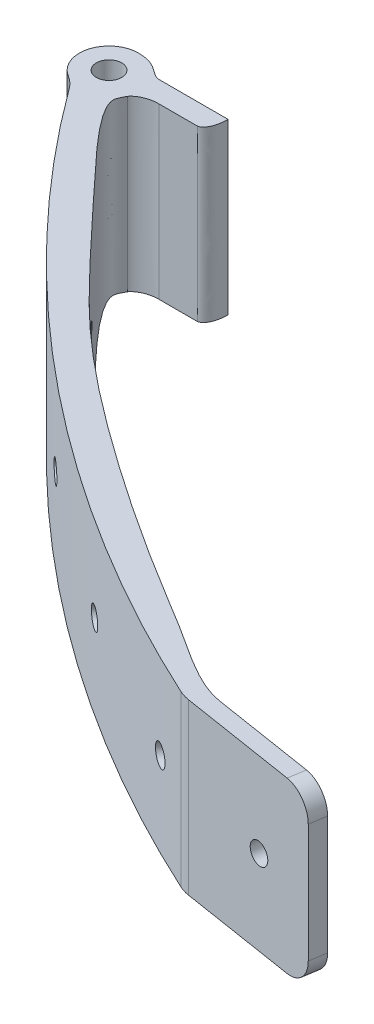
from build123d import *

# Parameters (mm, degrees)
SKETCH_1_R               = 1.5
EXTRUDE_1_DEPTH          = 20
SKETCH_2_R               = 1.25
CUT_EXTRUDE_1_DEPTH      = 117.587125453
CUT_EXTRUDE_2_DEPTH      = 125.160942129
CUT_EXTRUDE_2_DEPTH_BACK = 125.160942129
SKETCH_5_R               = 1.25
CUT_EXTRUDE_START        = -5
SKETCH_6_R               = 1.25
CUT_EXTRUDE_3_DEPTH      = 78.365221441
CUT_EXTRUDE_START_2      = 10
SKETCH_7_R               = 1.25
CUT_EXTRUDE_5_DEPTH      = 81.224751973
SKETCH_8_R               = 1.25
CUT_EXTRUDE_6_DEPTH      = 97.006719329
FILLET_1_R               = 3


with BuildPart() as part:
    # Эскиз1 → Бобышка-Вытянуть1 (new body)
    with BuildSketch(Plane(origin=(0, 0, 0), x_dir=(1, 0, 0), z_dir=(0, 1, 0))):
        with BuildLine():
            Line((77.201963586, -81.223148621), (93.992665376, -83.882534527))
            Line((93.992665376, -83.882534527), (94.305534306, -81.907157846))
            Line((94.305534306, -81.907157846), (79.490209197, -79.56064087))
            add(Edge.make_bspline(
                [(79.490209197, -79.56064087), (76.256773952, -79.154348442), (71.656260447, -75.733682797), (61.0670462, -69.403824403), (49.779121917, -62.08745812), (36.271463551, -52.16601557), (26.152496922, -41.879924323), (21.275507444, -36.599319235), (15.121863873, -30.013690286), (10.698464666, -24.931258261), (11.523891951, -23.700720545), (11.847061913, -23.072072966)],
                knots=[0, 0, 0, 0, 0.11695499, 0.15293265, 0.359776594, 0.631849253, 0.683687702, 0.856552932, 0.887565935, 0.972209575, 1, 1, 1, 1], degree=3))
            add(Edge.make_bspline(
                [(11.847061913, -23.072072966), (12.250121588, -22.515440182), (13.311252633, -21.971386221), (14.497358583, -22)],
                knots=[0, 0, 0, 0, 1, 1, 1, 1], degree=3))
            Line((14.497358583, -22), (18.997358583, -22))
            add(Edge.make_bspline(
                [(20.143207518, -19.5), (20.126602545, -21.364997031), (19.36969675, -21.993414121), (18.997358583, -22)],
                knots=[0, 0, 0, 0, 1, 1, 1, 1], degree=3))
            Line((20.143207518, -19.5), (12.143207518, -19.5))
            add(Edge.make_bspline(
                [(8.070926194, -18), (10.594209658, -18.022875603), (10.911300873, -19.549452414), (12.143207518, -19.5)],
                knots=[0, 0, 0, 0, 1, 1, 1, 1], degree=3))
            ThreePointArc((8.070926194, -18), (4.704156478, -20.54351598), (6.230776804, -24.477221897))
            ThreePointArc((6.230776804, -24.477221897), (6.996911803, -25.059630547), (7.63727688, -25.778028236))
            add(Edge.make_bspline(
                [(7.63727688, -25.778028236), (33.668412058, -61.357283375), (75.890541462, -80.825286428)],
                knots=[4.149854874, 4.149854874, 4.149854874, 4.761288535, 4.761288535, 4.761288535], degree=2, weights=[1, 0.953631448, 1]))
            ThreePointArc((75.890541462, -80.825286428), (76.532556696, -81.069361324), (77.201963586, -81.223148621))
        make_face()
        with Locations(Location((8.070926194, -21.5, 0), (0, 0, 270))):
            Circle(SKETCH_1_R, mode=Mode.SUBTRACT)
    extrude(amount=EXTRUDE_1_DEPTH)

    # Эскиз2 → Вырез-Вытянуть1 (cut, through all)
    with BuildSketch(Plane(origin=(-10.347531177, 0, 65.331740641), x_dir=(-0.9876883405951379, 0, -0.1564344650402302), z_dir=(0.1564344650402302, 0, -0.9876883405951379))):
        with Locations((-98.957579108, 10)):
            Circle(SKETCH_2_R)
    extrude(amount=-CUT_EXTRUDE_1_DEPTH, mode=Mode.SUBTRACT)

    # Эскиз5 → Вырез-Вытянуть2 (cut, two sides: drawn at the far end of the back side and taken through both)
    with BuildSketch(Plane(origin=(-15.990680125, 0, 30.490731825), x_dir=(-0.8856004845364605, 0, -0.46444782461411815), z_dir=(0.46444782461411815, 0, -0.8856004845364605)).offset(-CUT_EXTRUDE_2_DEPTH_BACK)):
        with Locations((-99.552036869, 10)):
            Circle(SKETCH_5_R)
    extrude(amount=CUT_EXTRUDE_2_DEPTH + CUT_EXTRUDE_2_DEPTH_BACK, mode=Mode.SUBTRACT)

    # Эскиз6 → Вырез-Вытянуть3 (cut, through all)
    with BuildSketch(Plane(origin=(54.393770316, 20, 66.522257307), x_dir=(0.8485916557225819, 0, 0.52904839271848), z_dir=(-0.52904839271848, 0, 0.8485916557225819)).offset(CUT_EXTRUDE_START)):
        with Locations(Location((0, -10, 0), (0, 0, 180))):
            Circle(SKETCH_6_R)
    extrude(amount=CUT_EXTRUDE_3_DEPTH, mode=Mode.SUBTRACT)

    # Эскиз7 → Вырез-Вытянуть5 (cut, through all)
    with BuildSketch(Plane(origin=(37.475559405, 20, 54.081431788), x_dir=(-0.7307904020014915, 0, -0.682601925240838), z_dir=(0.682601925240838, 0, -0.7307904020014915)).offset(CUT_EXTRUDE_START_2)):
        with Locations((0, -10)):
            Circle(SKETCH_7_R)
    extrude(amount=-CUT_EXTRUDE_5_DEPTH, mode=Mode.SUBTRACT)

    # Эскиз8 → Вырез-Вытянуть6 (cut, through all)
    with BuildSketch(Plane(origin=(22.769096862, 20, 40.527098184), x_dir=(-0.6506264122597583, 0, -0.759397966595905), z_dir=(0.759397966595905, 0, -0.6506264122597583)).offset(CUT_EXTRUDE_START_2)):
        with Locations((0, -10)):
            Circle(SKETCH_8_R)
    extrude(amount=-CUT_EXTRUDE_6_DEPTH, mode=Mode.SUBTRACT)

    # Скругление1
    fillet_1_edges = [part.edges().sort_by_distance(p)[0] for p in [
        (94.149099841, 0, 82.894846186),
        (94.149099841, 20, 82.894846186),
    ]]
    fillet(fillet_1_edges, radius=FILLET_1_R)


solid = part.part
